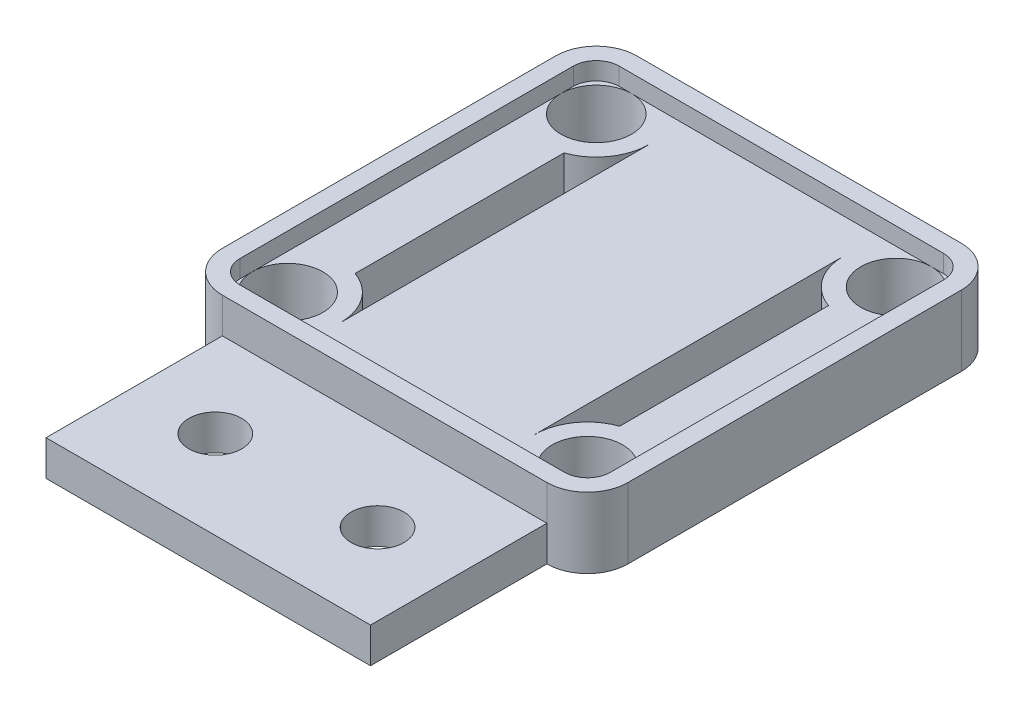
from build123d import *

# Parameters (mm, degrees)
BOSS_EXTRUDE1_DEPTH = 4
CUT_EXTRUDE2_DEPTH  = 1
SKETCH5_R           = 2
CUT_EXTRUDE3_DEPTH  = 22.132971525
CUT_EXTRUDE4_DEPTH  = 22.132971525
SKETCH7_W           = 18.4
SKETCH7_H           = 2
BOSS_EXTRUDE2_DEPTH = 10
SKETCH8_R           = 1.5
CUT_EXTRUDE5_DEPTH  = 25.154392176


with BuildPart() as part:
    # Sketch1 → Boss-Extrude1 (new body)
    with BuildSketch(Plane(origin=(0, 0, 0), x_dir=(1, 0, 0), z_dir=(0, 1, 0))):
        with BuildLine():
            Line((-12.649074074, 14.633101852), (5.750925926, 14.633101852))
            ThreePointArc((5.750925926, 14.633101852), (7.377271523, 13.959447449), (8.050925926, 12.333101852))
            Line((8.050925926, 12.333101852), (8.050925926, -6.566898148))
            ThreePointArc((8.050925926, -6.566898148), (7.377271523, -8.193243745), (5.750925926, -8.866898148))
            Line((5.750925926, -8.866898148), (-12.649074074, -8.866898148))
            ThreePointArc((-12.649074074, -8.866898148), (-14.275419671, -8.193243745), (-14.949074074, -6.566898148))
            Line((-14.949074074, -6.566898148), (-14.949074074, 12.333101852))
            ThreePointArc((-14.949074074, 12.333101852), (-14.275419671, 13.959447449), (-12.649074074, 14.633101852))
        make_face()
    extrude(amount=BOSS_EXTRUDE1_DEPTH)

    # Sketch2 → Cut-Extrude2 (cut)
    with BuildSketch(Plane(origin=(0, 4, 0), x_dir=(1, 0, 0), z_dir=(0, 1, 0))):
        with BuildLine():
            Line((5.750925926, 13.633101852), (-12.649074074, 13.633101852))
            ThreePointArc((-12.649074074, 13.633101852), (-13.56831289, 13.252340667), (-13.949074074, 12.333101852))
            Line((-13.949074074, 12.333101852), (-13.949074074, -6.566898148))
            ThreePointArc((-13.949074074, -6.566898148), (-13.56831289, -7.486136964), (-12.649074074, -7.866898148))
            Line((-12.649074074, -7.866898148), (5.750925926, -7.866898148))
            ThreePointArc((5.750925926, -7.866898148), (6.670164741, -7.486136964), (7.050925926, -6.566898148))
            Line((7.050925926, -6.566898148), (7.050925926, 12.333101852))
            ThreePointArc((7.050925926, 12.333101852), (6.670164741, 13.252340667), (5.750925926, 13.633101852))
        make_face()
    extrude(amount=-CUT_EXTRUDE2_DEPTH, mode=Mode.SUBTRACT)

    # Sketch5 → Cut-Extrude3 (cut, through all)
    with BuildSketch(Plane(origin=(0, 3, 0), x_dir=(1, 0, 0), z_dir=(0, 1, 0))):
        with Locations(Location((5.050925926, 11.633101852, 0), (0, 0, 270))):
            Circle(SKETCH5_R)
        with Locations(Location((5.050925926, -5.866898148, 0), (0, 0, 270))):
            Circle(SKETCH5_R)
        with Locations(Location((-11.949074074, -5.866898148, 0), (0, 0, 270))):
            Circle(SKETCH5_R)
        with Locations(Location((-11.949074074, 11.633101852, 0), (0, 0, 90))):
            Circle(SKETCH5_R)
    extrude(amount=-CUT_EXTRUDE3_DEPTH, mode=Mode.SUBTRACT)

    # Sketch6 → Cut-Extrude4 (cut, through all)
    with BuildSketch(Plane(origin=(0, 3, 0), x_dir=(1, 0, 0), z_dir=(0, 1, 0))):
        with BuildLine():
            Line((4.050925926, -3.038471023), (4.050925926, 8.804674727))
            ThreePointArc((4.050925926, 8.804674727), (2.601436183, 9.901051044), (2.050925926, 11.633101852))
            Line((2.050925926, 11.633101852), (2.050925926, -5.866898148))
            ThreePointArc((2.050925926, -5.866898148), (2.601436183, -4.134847341), (4.050925926, -3.038471023))
        make_face()
        with BuildLine():
            Line((-10.949074074, 8.804674727), (-10.949074074, -3.038471023))
            ThreePointArc((-10.949074074, -3.038471023), (-9.499584331, -4.134847341), (-8.949074074, -5.866898148))
            Line((-8.949074074, -5.866898148), (-8.949074074, 11.633101852))
            ThreePointArc((-8.949074074, 11.633101852), (-9.499584331, 9.901051044), (-10.949074074, 8.804674727))
        make_face()
    extrude(amount=-CUT_EXTRUDE4_DEPTH, mode=Mode.SUBTRACT)

    # Sketch7 → Boss-Extrude2 (add)
    with BuildSketch(Plane.XY.offset(8.866898148)):
        with Locations((-3.449074074, 1)):
            Rectangle(SKETCH7_W, SKETCH7_H)
    extrude(amount=BOSS_EXTRUDE2_DEPTH)

    # Sketch8 → Cut-Extrude5 (cut, through all)
    with BuildSketch(Plane(origin=(0, 2, 0), x_dir=(1, 0, 0), z_dir=(0, 1, 0))):
        with Locations(Location((1.150925926, -13.866898148, 0), (0, 0, 270))):
            Circle(SKETCH8_R)
        with Locations(Location((-8.049074074, -13.866898148, 0), (0, 0, 270))):
            Circle(SKETCH8_R)
    extrude(amount=-CUT_EXTRUDE5_DEPTH, mode=Mode.SUBTRACT)


solid = part.part
